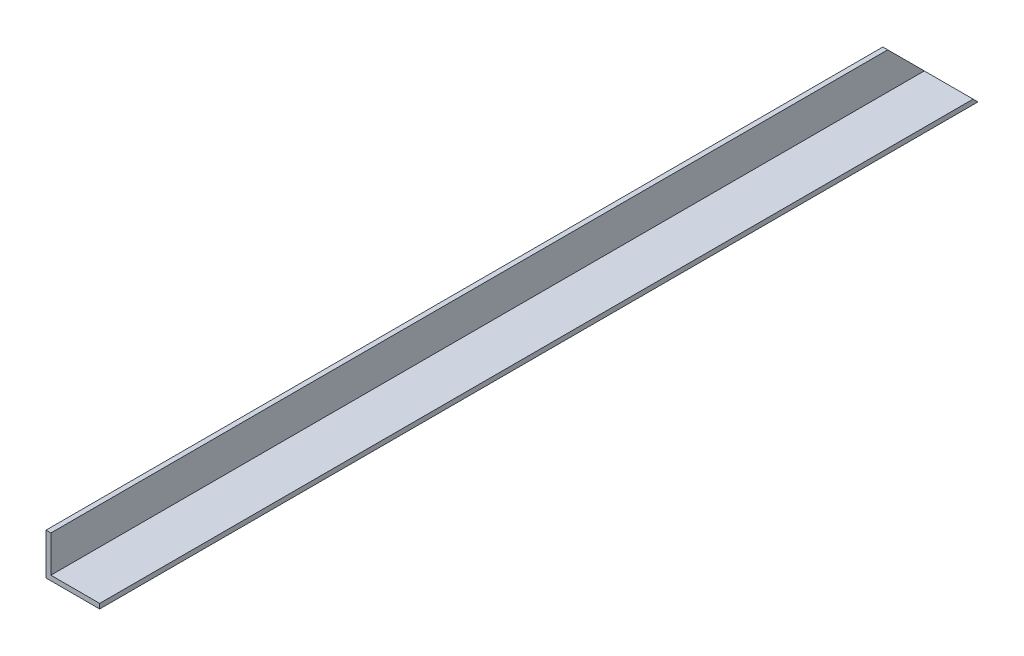
from build123d import *

# Parameters (mm, degrees)
BOSS_EXTRUDE1_DEPTH = 360
CUT_EXTRUDE1_DEPTH  = 360


with BuildPart() as part:
    # Sketch2 → Boss-Extrude1 (new body)
    with BuildSketch(Plane.XY):
        Polygon((0, 0), (0, 17), (2, 17), (2, 2), (22, 2), (22, 0), align=None)
    extrude(amount=BOSS_EXTRUDE1_DEPTH)

    # Sketch3 → Cut-Extrude1 (cut)
    with BuildSketch(Plane.ZY):
        Polygon((0, 0), (17, 17), (0, 17), align=None)
    extrude(amount=-CUT_EXTRUDE1_DEPTH, mode=Mode.SUBTRACT)


solid = part.part
